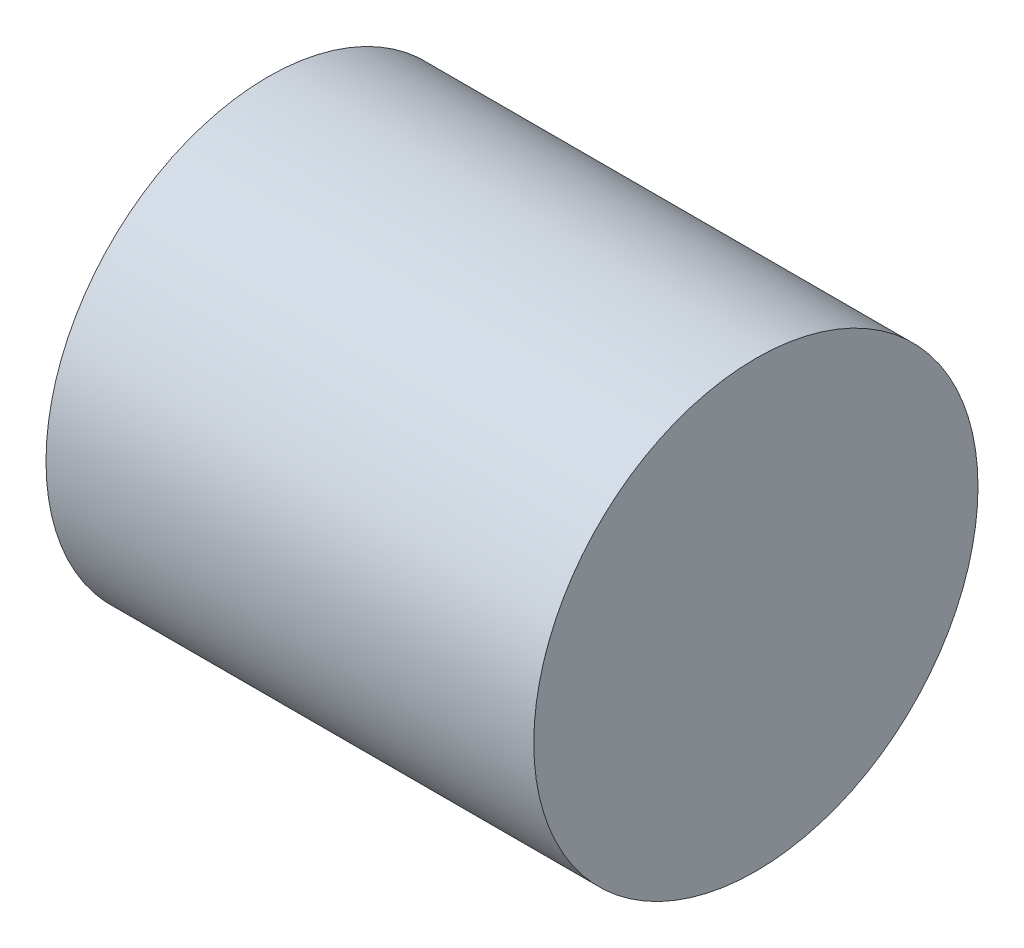
from build123d import *

# Parameters (mm, degrees)
SKETCH1_R           = 25.939110013
BOSS_EXTRUDE1_DEPTH = 56.96458


with BuildPart() as part:
    # Sketch1 → Boss-Extrude1 (new body)
    with BuildSketch(Plane(origin=(0, 0, 0), x_dir=(0, 0, -1), z_dir=(1, 0, 0))):
        with Locations((86.798404, 438.166256)):
            Circle(SKETCH1_R)
    extrude(amount=BOSS_EXTRUDE1_DEPTH)


solid = part.part
